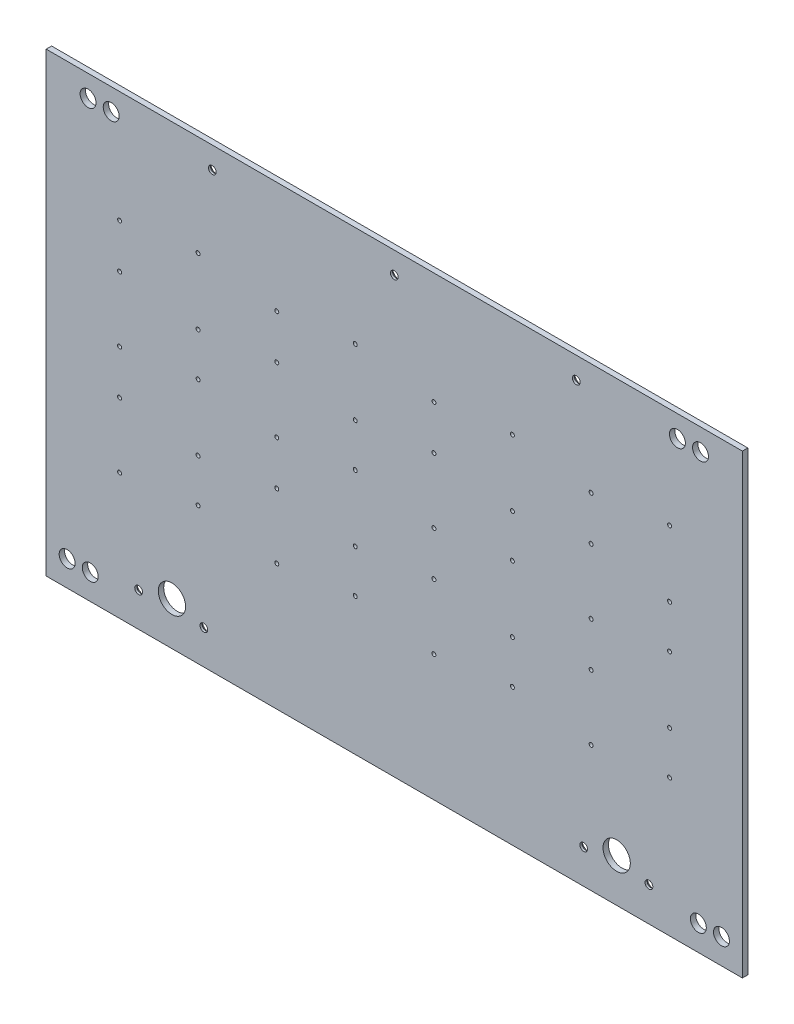
from build123d import *

# Parameters (mm, degrees)
SKETCH1_W                                      = 306.05
SKETCH1_H                                      = 197.425
SKETCH1_R                                      = 10.775
BOSS_EXTRUDE1_DEPTH                            = 2.38125
SKETCH9_W                                      = 306.05
SKETCH9_H                                      = 2.38125
BOSS_EXTRUDE2_DEPTH                            = 3.175
SKETCH10_R                                     = 3.5
CUT_EXTRUDE1_DEPTH                             = 184.856965146
CSK_FOR_M3_FLAT_HEAD_MACHINE_SCREW1_AT_2_COUNT = 2
CSK_FOR_M3_FLAT_HEAD_MACHINE_SCREW1_AT_2_PITCH = 28.69
CSK_FOR_M3_FLAT_HEAD_MACHINE_SCREW1_AT_3_COUNT = 2
CSK_FOR_M3_FLAT_HEAD_MACHINE_SCREW1_AT_3_PITCH = 178.948509983
CSK_FOR_M3_FLAT_HEAD_MACHINE_SCREW1_AT_4_COUNT = 2
CSK_FOR_M3_FLAT_HEAD_MACHINE_SCREW1_AT_4_PITCH = 208.645558843
CSK_FOR_M3_FLAT_HEAD_MACHINE_SCREW1_AT_5_COUNT = 2
CSK_FOR_M3_FLAT_HEAD_MACHINE_SCREW1_AT_5_PITCH = 260.467597265
CSK_FOR_M3_FLAT_HEAD_MACHINE_SCREW1_AT_6_COUNT = 2
CSK_FOR_M3_FLAT_HEAD_MACHINE_SCREW1_AT_6_PITCH = 224.342
CSK_FOR_M3_FLAT_HEAD_MACHINE_SCREW1_AT_7_COUNT = 2
CSK_FOR_M3_FLAT_HEAD_MACHINE_SCREW1_AT_7_PITCH = 195.652
SKETCH13_R                                     = 6
CUT_EXTRUDE2_DEPTH                             = 184.856965146
SKETCH15_R                                     = 0.875
CUT_EXTRUDE3_DEPTH                             = 184.856965146


with BuildPart() as part:
    # Sketch1 → Boss-Extrude1 (new body)
    # profile 1 of 5: a face of its own
    with BuildSketch(Plane.XY):
        Rectangle(SKETCH1_W, SKETCH1_H)
        with Locations((-142.25, -87.9375)):
            Circle(SKETCH1_R, mode=Mode.SUBTRACT)
        with Locations((-130.25, -64.9375)):
            Circle(SKETCH1_R, mode=Mode.SUBTRACT)
    # profile 2 of 5: a face of its own
    with BuildSketch(Plane.XY):
        with Locations((-130.25, -64.9375)):
            Circle(SKETCH1_R)
    # profile 3 of 5: a face of its own
    with BuildSketch(Plane.XY):
        with Locations((-142.25, -87.9375)):
            Circle(SKETCH1_R)
    # profile 4 of 5: a face of its own
    with BuildSketch(Plane.XY):
        with BuildLine():
            ThreePointArc((-142.25, -98.7125), (-149.869075567, -95.556575567), (-153.025, -87.9375))
            Line((-153.025, -87.9375), (-153.025, -98.7125))
            Line((-153.025, -98.7125), (-142.25, -98.7125))
        make_face()
    # profile 5 of 5: a face of its own
    with BuildSketch(Plane.XY):
        Rectangle(SKETCH1_W, SKETCH1_H)
    extrude(amount=BOSS_EXTRUDE1_DEPTH)

    # Sketch9 → Boss-Extrude2 (add)
    with BuildSketch(Plane(origin=(0, 98.7125, 0), x_dir=(1, 0, 0), z_dir=(0, 1, 0))):
        with Locations((0, -1.190625)):
            Rectangle(SKETCH9_W, SKETCH9_H)
    extrude(amount=BOSS_EXTRUDE2_DEPTH)

    # Sketch10 → Cut-Extrude1 (cut, through all)
    with BuildSketch(Plane(origin=(0, 0, 0), x_dir=(-1, 0, 0), z_dir=(0, 0, -1))):
        with Locations((-134.610000066, 92.3625)):
            Circle(SKETCH10_R)
        with Locations((-124.450000066, 92.3625)):
            Circle(SKETCH10_R)
        with Locations((-143.817500066, -87.5375001)):
            Circle(SKETCH10_R)
        with Locations((-133.657500066, -87.5375001)):
            Circle(SKETCH10_R)
    cut_extrude1 = extrude(amount=-CUT_EXTRUDE1_DEPTH, mode=Mode.SUBTRACT)

    # Mirror1: Cut-Extrude1 across plane
    add(cut_extrude1.mirror(Plane(origin=(0, 0, 0), x_dir=(0, 0, 1), z_dir=(1, 0, 0))), mode=Mode.SUBTRACT)

    # Sketch12 → CSK for M3 Flat Head Machine Screw1 (revolve, cut)
    with BuildSketch(Plane(origin=(111.94, -83.7125, 0), x_dir=(0, 1, 0), z_dir=(1, 0, 0))):
        Polygon((0, 0), (0, 2.38125), (1.7, 2.38125), (1.7, 1.45), (3.15, 0), align=None)
    csk_for_m3_flat_head_machine_screw1 = revolve(axis=Axis((111.94, -83.7125, -6.35), (0, 0, 1)), mode=Mode.SUBTRACT)

    # CSK for M3 Flat Head Machine Screw1 at 2: CSK for M3 Flat Head Machine Screw1 ×2
    with Locations(*[(-i * CSK_FOR_M3_FLAT_HEAD_MACHINE_SCREW1_AT_2_PITCH, 0, 0) for i in range(1, CSK_FOR_M3_FLAT_HEAD_MACHINE_SCREW1_AT_2_COUNT)]):
        add(csk_for_m3_flat_head_machine_screw1, mode=Mode.SUBTRACT)

    # CSK for M3 Flat Head Machine Screw1 at 3: CSK for M3 Flat Head Machine Screw1 ×2
    with Locations(*[Vector(-0.17848709666869095, 0.9839422525345588, 0) * (i * CSK_FOR_M3_FLAT_HEAD_MACHINE_SCREW1_AT_3_PITCH) for i in range(1, CSK_FOR_M3_FLAT_HEAD_MACHINE_SCREW1_AT_3_COUNT)]):
        add(csk_for_m3_flat_head_machine_screw1, mode=Mode.SUBTRACT)

    # CSK for M3 Flat Head Machine Screw1 at 4: CSK for M3 Flat Head Machine Screw1 ×2
    with Locations(*[Vector(-0.5365079449598529, 0.8438952689729665, 0) * (i * CSK_FOR_M3_FLAT_HEAD_MACHINE_SCREW1_AT_4_PITCH) for i in range(1, CSK_FOR_M3_FLAT_HEAD_MACHINE_SCREW1_AT_4_COUNT)]):
        add(csk_for_m3_flat_head_machine_screw1, mode=Mode.SUBTRACT)

    # CSK for M3 Flat Head Machine Screw1 at 5: CSK for M3 Flat Head Machine Screw1 ×2
    with Locations(*[Vector(-0.7369054808176367, 0.6759957931384838, 0) * (i * CSK_FOR_M3_FLAT_HEAD_MACHINE_SCREW1_AT_5_PITCH) for i in range(1, CSK_FOR_M3_FLAT_HEAD_MACHINE_SCREW1_AT_5_COUNT)]):
        add(csk_for_m3_flat_head_machine_screw1, mode=Mode.SUBTRACT)

    # CSK for M3 Flat Head Machine Screw1 at 6: CSK for M3 Flat Head Machine Screw1 ×2
    with Locations(*[(-i * CSK_FOR_M3_FLAT_HEAD_MACHINE_SCREW1_AT_6_PITCH, 0, 0) for i in range(1, CSK_FOR_M3_FLAT_HEAD_MACHINE_SCREW1_AT_6_COUNT)]):
        add(csk_for_m3_flat_head_machine_screw1, mode=Mode.SUBTRACT)

    # CSK for M3 Flat Head Machine Screw1 at 7: CSK for M3 Flat Head Machine Screw1 ×2
    with Locations(*[(-i * CSK_FOR_M3_FLAT_HEAD_MACHINE_SCREW1_AT_7_PITCH, 0, 0) for i in range(1, CSK_FOR_M3_FLAT_HEAD_MACHINE_SCREW1_AT_7_COUNT)]):
        add(csk_for_m3_flat_head_machine_screw1, mode=Mode.SUBTRACT)

    # Sketch13 → Cut-Extrude2 (cut, through all)
    with BuildSketch(Plane(origin=(0, 0, 0), x_dir=(-1, 0, 0), z_dir=(0, 0, -1))):
        with Locations((-97.75, -79.7125001)):
            Circle(SKETCH13_R)
        with Locations((97.75, -79.7125001)):
            Circle(SKETCH13_R)
    extrude(amount=-CUT_EXTRUDE2_DEPTH, mode=Mode.SUBTRACT)

    # Sketch15 → Cut-Extrude3 (cut, through all)
    with BuildSketch(Plane(origin=(0, 0, 0), x_dir=(-1, 0, 0), z_dir=(0, 0, -1))):
        with Locations((86.25, 9.595433878)):
            Circle(SKETCH15_R)
        with Locations((-51.926, 57.596353878)):
            Circle(SKETCH15_R)
        with Locations((-17.426, 52.781407709)):
            Circle(SKETCH15_R)
        with Locations((-86.514, -43.220432291)):
            Circle(SKETCH15_R)
        with Locations((-121.014, -38.405486122)):
            Circle(SKETCH15_R)
        with Locations((-121.014, -19.469513878)):
            Circle(SKETCH15_R)
        with Locations((-86.514, -14.65456771)):
            Circle(SKETCH15_R)
        with Locations((-86.514, 4.780487709)):
            Circle(SKETCH15_R)
        with Locations((-121.014, 9.595433878)):
            Circle(SKETCH15_R)
        with Locations((-121.014, 28.536486122)):
            Circle(SKETCH15_R)
        with Locations((-86.514, 33.35143229)):
            Circle(SKETCH15_R)
        with Locations((-86.514, 52.781407709)):
            Circle(SKETCH15_R)
        with Locations((-121.014, 57.596353878)):
            Circle(SKETCH15_R)
        with Locations((-51.926, 28.536486122)):
            Circle(SKETCH15_R)
        with Locations((-17.426, 33.35143229)):
            Circle(SKETCH15_R)
        with Locations((-17.426, 4.780487709)):
            Circle(SKETCH15_R)
        with Locations((-51.926, 9.595433878)):
            Circle(SKETCH15_R)
        with Locations((-51.926, -19.469513878)):
            Circle(SKETCH15_R)
        with Locations((-17.426, -14.65456771)):
            Circle(SKETCH15_R)
        with Locations((-51.926, -38.405486122)):
            Circle(SKETCH15_R)
        with Locations((-17.426, -43.220432291)):
            Circle(SKETCH15_R)
        with Locations((17.162, -38.405486122)):
            Circle(SKETCH15_R)
        with Locations((17.162, -19.469513878)):
            Circle(SKETCH15_R)
        with Locations((51.662, -14.65456771)):
            Circle(SKETCH15_R)
        with Locations((17.162, 9.595433878)):
            Circle(SKETCH15_R)
        with Locations((51.662, 4.780487709)):
            Circle(SKETCH15_R)
        with Locations((51.662, 33.35143229)):
            Circle(SKETCH15_R)
        with Locations((17.162, 28.536486122)):
            Circle(SKETCH15_R)
        with Locations((17.162, 57.596353878)):
            Circle(SKETCH15_R)
        with Locations((51.662, 52.781407709)):
            Circle(SKETCH15_R)
        with Locations((86.25, 57.596353878)):
            Circle(SKETCH15_R)
        with Locations((120.75, 52.781407709)):
            Circle(SKETCH15_R)
        with Locations((86.25, 28.536486122)):
            Circle(SKETCH15_R)
        with Locations((120.75, 33.35143229)):
            Circle(SKETCH15_R)
        with Locations((51.662, -43.220432291)):
            Circle(SKETCH15_R)
        with Locations((86.25, -38.405486122)):
            Circle(SKETCH15_R)
        with Locations((86.25, -19.469513878)):
            Circle(SKETCH15_R)
        with Locations((120.75, 4.780487709)):
            Circle(SKETCH15_R)
        with Locations((120.75, -14.65456771)):
            Circle(SKETCH15_R)
        with Locations((120.75, -43.220432291)):
            Circle(SKETCH15_R)
    extrude(amount=-CUT_EXTRUDE3_DEPTH, mode=Mode.SUBTRACT)


solid = part.part
